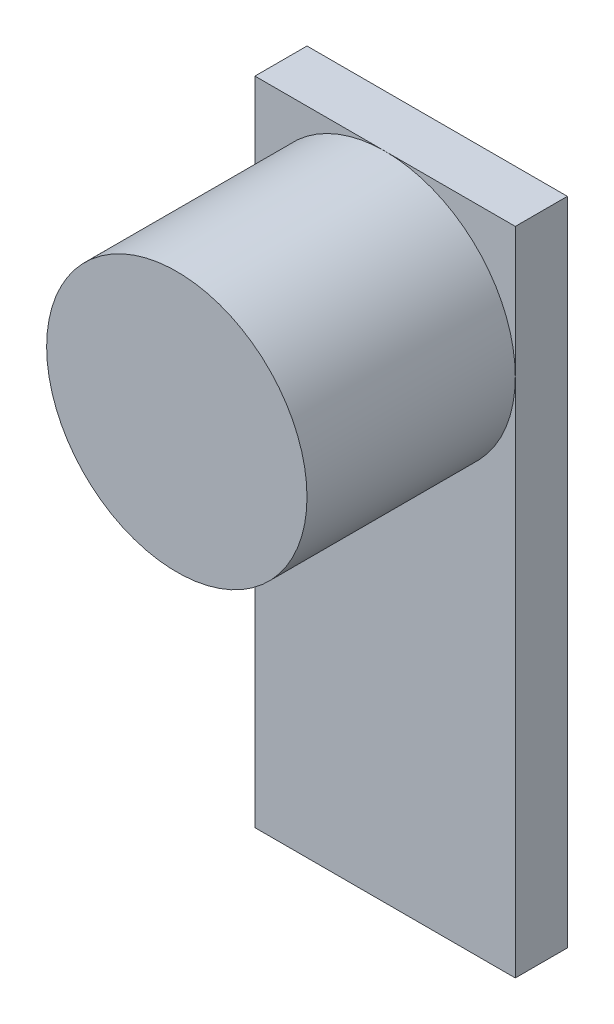
from build123d import *

# Parameters (mm, degrees)
SKETCH1_R           = 5000
BOSS_EXTRUDE4_DEPTH = 10000
SKETCH1_5_W         = 10000
SKETCH1_5_H         = 25000
BOSS_EXTRUDE5_DEPTH = 2000


with BuildPart() as part:
    # Sketch1 → Boss-Extrude4 (new body)
    with BuildSketch(Plane.XY):
        Circle(SKETCH1_R)
    extrude(amount=BOSS_EXTRUDE4_DEPTH)

    # Sketch1<5> → Boss-Extrude5 (add)
    with BuildSketch(Plane.XY):
        with Locations((0, -7500)):
            Rectangle(SKETCH1_5_W, SKETCH1_5_H)
    extrude(amount=BOSS_EXTRUDE5_DEPTH)


solid = part.part
